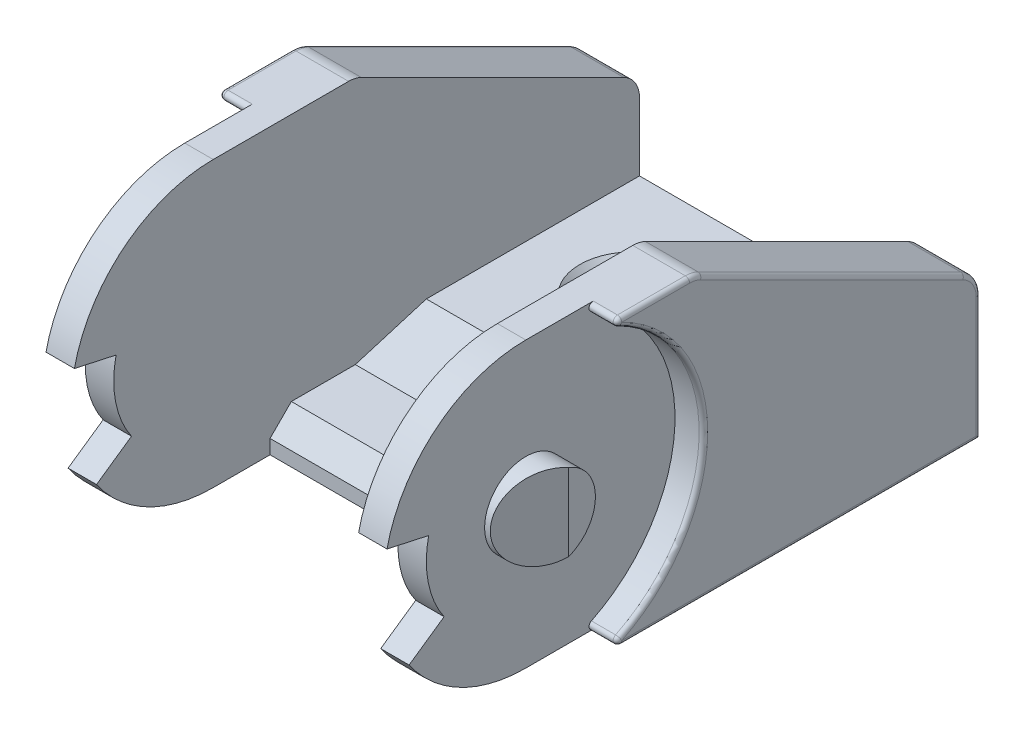
from build123d import *

# Parameters (mm, degrees)
BOSS_EXTRUDE1_DEPTH     = 14
SKETCH2_R               = 2.9
CUT_EXTRUDE1_DEPTH      = 48
CUT_EXTRUDE2_DEPTH      = 10
SKETCH6_R               = 10.5
CUT_EXTRUDE4_DEPTH      = 2
SKETCH8_R               = 2.9
BOSS_EXTRUDE2_DEPTH     = 4
CUT_EXTRUDE6_DEPTH      = 39.678159212
FILLET1_R               = 0.3
CUT_EXTRUDE3_DEPTH      = 4
CHAMFER1_SIZE           = 2
FILLET2_R               = 2
FILLET3_R               = 0.3
CUT_EXTRUDE5_DEPTH      = 35.583232932
CUT_EXTRUDE5_DEPTH_BACK = 35.583232932
CHAMFER2_SIZE           = 1.5


with BuildPart() as part:
    # Sketch1 → Boss-Extrude1 (new, symmetric)
    with BuildSketch(Plane(origin=(0, 0, 0), x_dir=(0, 0, -1), z_dir=(1, 0, 0))):
        with BuildLine():
            Line((30, -10), (0, -10))
            ThreePointArc((0, -10), (-10, 0), (0, 10))
            Line((0, 10), (30, 10))
            Line((30, 10), (30, -10))
        make_face()
    extrude(amount=BOSS_EXTRUDE1_DEPTH, both=True)

    # Sketch2 → Cut-Extrude1 (cut)
    with BuildSketch(Plane(origin=(14, 0, 0), x_dir=(0, 0, -1), z_dir=(1, 0, 0))):
        Circle(SKETCH2_R)
        Polygon((30, 0), (10, 10), (30, 10), align=None)
    extrude(amount=-CUT_EXTRUDE1_DEPTH, mode=Mode.SUBTRACT)

    # Sketch4 → Cut-Extrude2 (cut, symmetric)
    with BuildSketch(Plane(origin=(0, 0, 0), x_dir=(0, 0, -1), z_dir=(1, 0, 0))):
        with BuildLine():
            Line((0, -10), (4, -10))
            Line((4, -10), (4, -7.5))
            Line((4, -7.5), (10, -7.5))
            Line((10, -7.5), (15, -6))
            Line((15, -6), (30, -6))
            Line((30, -6), (30, 0))
            Line((30, 0), (10, 10))
            Line((10, 10), (0, 10))
            ThreePointArc((0, 10), (-10, 0), (0, -10))
        make_face()
    extrude(amount=CUT_EXTRUDE2_DEPTH, both=True, mode=Mode.SUBTRACT)

    # Sketch6 → Cut-Extrude4 (cut)
    with BuildSketch(Plane(origin=(-14, 0, 0), x_dir=(0, 0, -1), z_dir=(1, 0, 0))):
        Circle(SKETCH6_R)
    cut_extrude4 = extrude(amount=CUT_EXTRUDE4_DEPTH, mode=Mode.SUBTRACT)

    # Sketch8 → Boss-Extrude2 (add)
    with BuildSketch(Plane(origin=(-10, 0, 0), x_dir=(0, 0, -1), z_dir=(1, 0, 0))):
        Circle(SKETCH8_R)
    boss_extrude2 = extrude(amount=-BOSS_EXTRUDE2_DEPTH)

    # Sketch9 → Cut-Extrude6 (cut, through all)
    with BuildSketch(Plane(origin=(0, 10, 0), x_dir=(1, 0, 0), z_dir=(0, 1, 0))):
        Polygon((-14, 1), (-14, -2.9), (-12.4, -2.9), align=None)
    cut_extrude6 = extrude(amount=-CUT_EXTRUDE6_DEPTH, mode=Mode.SUBTRACT)

    # Mirror1: Cut-Extrude4, Boss-Extrude2, Cut-Extrude6 across plane
    add(cut_extrude4.mirror(Plane(origin=(0, 0, 0), x_dir=(0, 0, 1), z_dir=(1, 0, 0))), mode=Mode.SUBTRACT)
    add(boss_extrude2.mirror(Plane(origin=(0, 0, 0), x_dir=(0, 0, 1), z_dir=(1, 0, 0))))
    add(cut_extrude6.mirror(Plane(origin=(0, 0, 0), x_dir=(0, 0, 1), z_dir=(1, 0, 0))), mode=Mode.SUBTRACT)

    # Fillet1
    fillet1_edges = [part.edges().sort_by_distance(p)[0] for p in [
        (13, -10, -3.201562119),
        (13, 10, -3.201562119),
        (-13, -10, -3.201562119),
        (-13, 10, -3.201562119),
    ]]
    fillet(fillet1_edges, radius=FILLET1_R)

    # Sketch5 → Cut-Extrude3 (cut)
    with BuildSketch(Plane(origin=(0, -10, 0), x_dir=(1, 0, 0), z_dir=(0, 1, 0))):
        with BuildLine():
            Line((-3, 24.2), (3, 24.2))
            ThreePointArc((3, 24.2), (4.7, 22.5), (3, 20.8))
            Line((3, 20.8), (-3, 20.8))
            ThreePointArc((-3, 20.8), (-4.7, 22.5), (-3, 24.2))
        make_face()
    extrude(amount=CUT_EXTRUDE3_DEPTH, mode=Mode.SUBTRACT)

    # Chamfer1
    chamfer1_edges = [part.edges().sort_by_distance(p)[0] for p in [
        (0, -6, -24.2),
        (4.7, -6, -22.5),
        (0, -6, -20.8),
        (-4.7, -6, -22.5),
    ]]
    chamfer(chamfer1_edges, length=CHAMFER1_SIZE)

    # Fillet2
    fillet2_edges = [part.edges().sort_by_distance(p)[0] for p in [
        (-12, 0, -30),
        (-12, 10, -10),
        (12, 10, -10),
        (12, 0, -30),
    ]]
    fillet(fillet2_edges, radius=FILLET2_R)

    # Fillet3
    fillet3_edges = [part.edges().sort_by_distance(p)[0] for p in [
        (14, -5.618033989, -30),
        (14, 0, -10.5),
        (14, -10, -17.374342014),
        (14, -9.76770032, -4.45642273),
        (14, 9.76770032, -4.45642273),
        (-14, -10, -17.374342014),
        (-14, 0, -10.5),
        (-14, 9.76770032, -4.45642273),
        (-14, -9.76770032, -4.45642273),
        (-14, 5.170820393, -19.658359214),
        (-14, 10, -7.138274037),
        (-14, -0.184605753, -29.701301617),
        (-14, 9.946497979, -9.987369886),
        (14, 5.170820393, -19.658359214),
        (14, 10, -7.138274037),
        (14, -0.184605753, -29.701301617),
        (14, 9.946497979, -9.987369886),
        (-14, -5.618033989, -30),
    ]]
    fillet(fillet3_edges, radius=FILLET3_R)

    # Sketch7 → Cut-Extrude5 (cut, two sides: drawn at the far end of the back side and taken through both)
    with BuildSketch(Plane.ZY.offset(-CUT_EXTRUDE5_DEPTH_BACK)):
        with BuildLine():
            Line((9.767710237, 2.142857143), (6.837397166, 1.5))
            ThreePointArc((6.837397166, 1.5), (6.866578014, -1.360186158), (5.749248239, -3.993262411))
            Line((5.749248239, -3.993262411), (8.213211771, -5.704660587))
            ThreePointArc((8.213211771, -5.704660587), (9.809397162, -1.943123082), (9.767710237, 2.142857143))
        make_face()
    extrude(amount=CUT_EXTRUDE5_DEPTH + CUT_EXTRUDE5_DEPTH_BACK, mode=Mode.SUBTRACT)

    # Chamfer2
    chamfer2_edges = [part.edges().sort_by_distance(p)[0] for p in [
        (0, -7.5, -4),
    ]]
    chamfer(chamfer2_edges, length=CHAMFER2_SIZE)


solid = part.part
